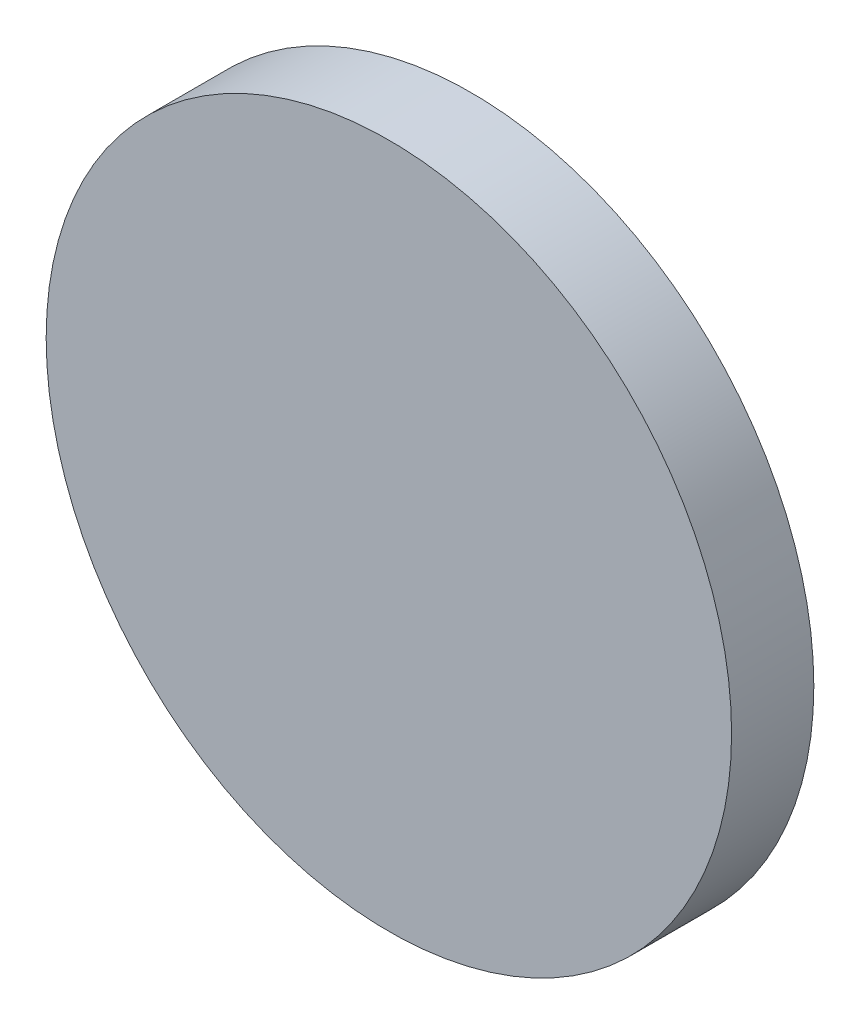
from build123d import *

# Parameters (mm, degrees)
SKETCH1_R           = 12.5
BOSS_EXTRUDE1_DEPTH = 3


with BuildPart() as part:
    # Sketch1 → Boss-Extrude1 (new body)
    with BuildSketch(Plane.XY):
        Circle(SKETCH1_R)
    extrude(amount=BOSS_EXTRUDE1_DEPTH)


solid = part.part
